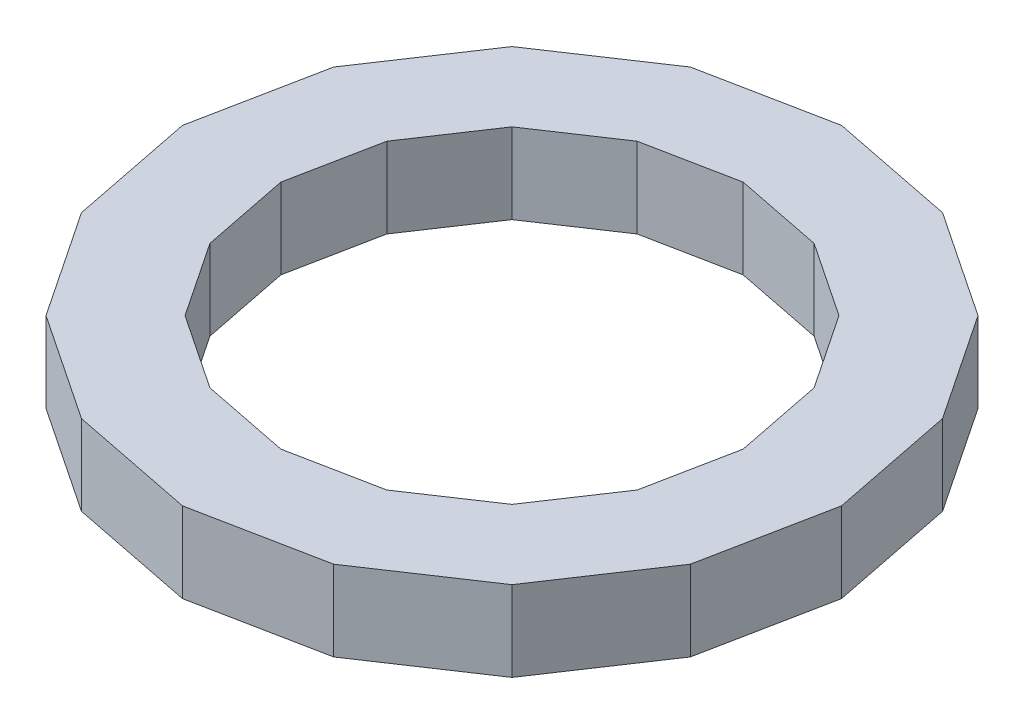
from build123d import *

# Parameters (mm, degrees)
BOSS_EXTRUDE1_DEPTH = 19.05


with BuildPart() as part:
    # Sketch1 → Boss-Extrude1 (new body)
    with BuildSketch(Plane(origin=(0, 0, 0), x_dir=(1, 0, 0), z_dir=(0, 1, 0))):
        Polygon((78.117662847, 0), (72.171309832, 29.894335347), (55.23752913, 55.23752913), (29.894335347, 72.171309832), (0, 78.117662847), (-29.894335347, 72.171309832), (-55.23752913, 55.23752913), (-72.171309832, 29.894335347), (-78.117662847, 0), (-72.171309832, -29.894335347), (-55.23752913, -55.23752913), (-29.894335347, -72.171309832), (0, -78.117662847), (29.894335347, -72.171309832), (55.23752913, -55.23752913), (72.171309832, -29.894335347), align=None)
        Polygon((54.809808971, 0), (50.637660689, 20.974805824), (38.756387599, 38.756387599), (20.974805824, 50.637660689), (0, 54.809808971), (-20.974805824, 50.637660689), (-38.756387599, 38.756387599), (-50.637660689, 20.974805824), (-54.809808971, 0), (-50.637660689, -20.974805824), (-38.756387599, -38.756387599), (-20.974805824, -50.637660689), (0, -54.809808971), (20.974805824, -50.637660689), (38.756387599, -38.756387599), (50.637660689, -20.974805824), align=None, mode=Mode.SUBTRACT)
    extrude(amount=BOSS_EXTRUDE1_DEPTH)


solid = part.part
